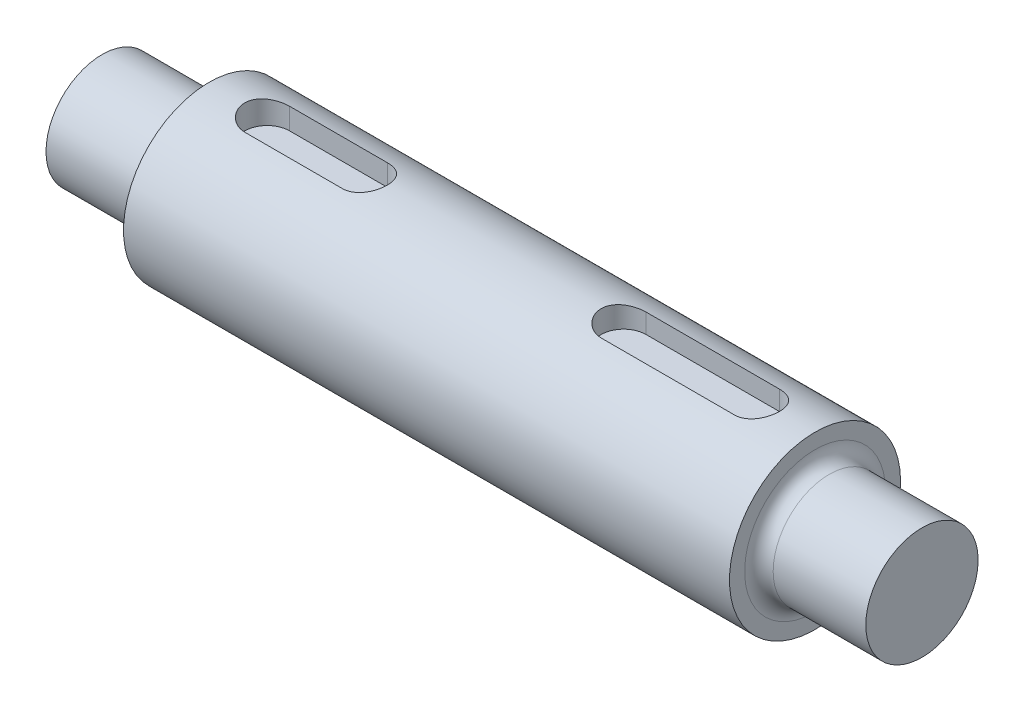
from build123d import *

# Parameters (mm, degrees)
SKETCH1_R                = 20
BOSS_EXTRUDE1_DEPTH      = 38.1
SKETCH2_R                = 30.48
BOSS_EXTRUDE2_DEPTH      = 215.9
SKETCH3_R                = 19.9999981
BOSS_EXTRUDE3_DEPTH      = 38.1
FILLET1_R                = 5.08
SKETCH6_W                = 16.002
SKETCH6_H                = 16.002
CUT_EXTRUDE1_DEPTH       = 50.8
SKETCH7_W                = 16
SKETCH7_H                = 16
CUT_EXTRUDE2_DEPTH       = 63.5
BOSS_EXTRUDE4_REACH      = 300.305
BOSS_EXTRUDE4_END_RADIUS = 30.48
BOSS_EXTRUDE5_REACH      = 300.423
BOSS_EXTRUDE5_END_RADIUS = 30.48


with BuildPart() as part:
    # Sketch1 → Boss-Extrude1 (new body)
    with BuildSketch(Plane(origin=(0, 0, 0), x_dir=(0, 0, -1), z_dir=(1, 0, 0))):
        with Locations(Location((0, 0, 0), (0, 0, 180))):
            Circle(SKETCH1_R)
    extrude(amount=BOSS_EXTRUDE1_DEPTH)

    # Sketch2 → Boss-Extrude2 (add)
    with BuildSketch(Plane(origin=(38.1, 0, 0), x_dir=(0, 0, -1), z_dir=(1, 0, 0))):
        Circle(SKETCH2_R)
    extrude(amount=BOSS_EXTRUDE2_DEPTH)

    # Sketch3 → Boss-Extrude3 (add)
    with BuildSketch(Plane(origin=(254, 0, 0), x_dir=(0, 0, -1), z_dir=(1, 0, 0))):
        with Locations(Location((0, 0, 0), (0, 0, 180))):
            Circle(SKETCH3_R)
    extrude(amount=BOSS_EXTRUDE3_DEPTH)

    # Fillet1
    fillet1_edges = [part.edges().sort_by_distance(p)[0] for p in [
        (38.1, 0, -20),
        (254, 0, -19.9999981),
    ]]
    fillet(fillet1_edges, radius=FILLET1_R)

    # Sketch6 → Cut-Extrude1 (cut)
    with BuildSketch(Plane(origin=(50.8, 0, 0), x_dir=(0, 0, -1), z_dir=(1, 0, 0))):
        with Locations((0, 29.812996)):
            Rectangle(SKETCH6_W, SKETCH6_H)
    extrude(amount=CUT_EXTRUDE1_DEPTH, mode=Mode.SUBTRACT)

    # Sketch7 → Cut-Extrude2 (cut)
    with BuildSketch(Plane.ZY.offset(-177.8)):
        with Locations((0, 30.48)):
            Rectangle(SKETCH7_W, SKETCH7_H)
    extrude(amount=-CUT_EXTRUDE2_DEPTH, mode=Mode.SUBTRACT)

    # Boss-Extrude4: up to this cylinder (the profile starts inside it)
    boss_extrude4_end = Plane(origin=(76.2, 0, 0), z_dir=(-1, 0, 0)) * Cylinder(BOSS_EXTRUDE4_END_RADIUS, 709.795666, mode=Mode.PRIVATE)
    # Sketch8 → Boss-Extrude4 (add, up to the surface)
    with BuildSketch(Plane(origin=(0, 21.811996, 0), x_dir=(1, 0, 0), z_dir=(0, 1, 0)), mode=Mode.PRIVATE) as boss_extrude4_sk1:
        with BuildLine():
            Line((58.801, 8.001), (50.8, 8.001))
            Line((50.8, 8.001), (50.8, 0))
            ThreePointArc((50.8, 0), (53.143438644, 5.657561356), (58.801, 8.001))
        make_face()
    boss_extrude4_tool1 = extrude(boss_extrude4_sk1.sketch, amount=BOSS_EXTRUDE4_REACH, mode=Mode.PRIVATE) & boss_extrude4_end
    add(boss_extrude4_tool1.solids().sort_by_distance((52.587167, 21.811996, -6.213833))[0])
    # Sketch8 → Boss-Extrude4 (add, up to the surface)
    with BuildSketch(Plane(origin=(0, 21.811996, 0), x_dir=(1, 0, 0), z_dir=(0, 1, 0)), mode=Mode.PRIVATE) as boss_extrude4_sk2:
        with BuildLine():
            ThreePointArc((58.801, -8.001), (53.143438644, -5.657561356), (50.8, 0))
            Line((50.8, 0), (50.8, -8.001))
            Line((50.8, -8.001), (58.801, -8.001))
        make_face()
    boss_extrude4_tool2 = extrude(boss_extrude4_sk2.sketch, amount=BOSS_EXTRUDE4_REACH, mode=Mode.PRIVATE) & boss_extrude4_end
    add(boss_extrude4_tool2.solids().sort_by_distance((52.587167, 21.811996, 6.213833))[0])
    # Sketch8 → Boss-Extrude4 (add, up to the surface)
    with BuildSketch(Plane(origin=(0, 21.811996, 0), x_dir=(1, 0, 0), z_dir=(0, 1, 0)), mode=Mode.PRIVATE) as boss_extrude4_sk3:
        with BuildLine():
            ThreePointArc((101.6, 0), (99.256561356, -5.657561356), (93.599, -8.001))
            Line((93.599, -8.001), (101.6, -8.001))
            Line((101.6, -8.001), (101.6, 0))
        make_face()
    boss_extrude4_tool3 = extrude(boss_extrude4_sk3.sketch, amount=BOSS_EXTRUDE4_REACH, mode=Mode.PRIVATE) & boss_extrude4_end
    add(boss_extrude4_tool3.solids().sort_by_distance((99.812833, 21.811996, 6.213833))[0])
    # Sketch8 → Boss-Extrude4 (add, up to the surface)
    with BuildSketch(Plane(origin=(0, 21.811996, 0), x_dir=(1, 0, 0), z_dir=(0, 1, 0)), mode=Mode.PRIVATE) as boss_extrude4_sk4:
        with BuildLine():
            Line((101.6, 8.001), (93.599, 8.001))
            ThreePointArc((93.599, 8.001), (99.256561356, 5.657561356), (101.6, 0))
            Line((101.6, 0), (101.6, 8.001))
        make_face()
    boss_extrude4_tool4 = extrude(boss_extrude4_sk4.sketch, amount=BOSS_EXTRUDE4_REACH, mode=Mode.PRIVATE) & boss_extrude4_end
    add(boss_extrude4_tool4.solids().sort_by_distance((99.812833, 21.811996, -6.213833))[0])

    # Boss-Extrude5: up to this cylinder (the profile starts inside it)
    boss_extrude5_end = Plane(origin=(209.55, 0, 0), z_dir=(-1, 0, 0)) * Cylinder(BOSS_EXTRUDE5_END_RADIUS, 722.732112, mode=Mode.PRIVATE)
    # Sketch10 → Boss-Extrude5 (add, up to the surface)
    with BuildSketch(Plane(origin=(0, 22.48, 0), x_dir=(1, 0, 0), z_dir=(0, 1, 0)), mode=Mode.PRIVATE) as boss_extrude5_sk1:
        with BuildLine():
            ThreePointArc((177.8, 0), (180.143145751, 5.656854249), (185.8, 8))
            Line((185.8, 8), (177.8, 8))
            Line((177.8, 8), (177.8, 0))
        make_face()
    boss_extrude5_tool1 = extrude(boss_extrude5_sk1.sketch, amount=BOSS_EXTRUDE5_REACH, mode=Mode.PRIVATE) & boss_extrude5_end
    add(boss_extrude5_tool1.solids().sort_by_distance((179.586944, 22.48, -6.213056))[0])
    # Sketch10 → Boss-Extrude5 (add, up to the surface)
    with BuildSketch(Plane(origin=(0, 22.48, 0), x_dir=(1, 0, 0), z_dir=(0, 1, 0)), mode=Mode.PRIVATE) as boss_extrude5_sk2:
        with BuildLine():
            ThreePointArc((185.8, -8), (180.143145751, -5.656854249), (177.8, 0))
            Line((177.8, 0), (177.8, -8))
            Line((177.8, -8), (185.8, -8))
        make_face()
    boss_extrude5_tool2 = extrude(boss_extrude5_sk2.sketch, amount=BOSS_EXTRUDE5_REACH, mode=Mode.PRIVATE) & boss_extrude5_end
    add(boss_extrude5_tool2.solids().sort_by_distance((179.586944, 22.48, 6.213056))[0])
    # Sketch10 → Boss-Extrude5 (add, up to the surface)
    with BuildSketch(Plane(origin=(0, 22.48, 0), x_dir=(1, 0, 0), z_dir=(0, 1, 0)), mode=Mode.PRIVATE) as boss_extrude5_sk3:
        with BuildLine():
            Line((241.3, -8), (241.3, 0))
            ThreePointArc((241.3, 0), (238.956854249, -5.656854249), (233.3, -8))
            Line((233.3, -8), (241.3, -8))
        make_face()
    boss_extrude5_tool3 = extrude(boss_extrude5_sk3.sketch, amount=BOSS_EXTRUDE5_REACH, mode=Mode.PRIVATE) & boss_extrude5_end
    add(boss_extrude5_tool3.solids().sort_by_distance((239.513056, 22.48, 6.213056))[0])
    # Sketch10 → Boss-Extrude5 (add, up to the surface)
    with BuildSketch(Plane(origin=(0, 22.48, 0), x_dir=(1, 0, 0), z_dir=(0, 1, 0)), mode=Mode.PRIVATE) as boss_extrude5_sk4:
        with BuildLine():
            Line((241.3, 8), (233.3, 8))
            ThreePointArc((233.3, 8), (238.956854249, 5.656854249), (241.3, 0))
            Line((241.3, 0), (241.3, 8))
        make_face()
    boss_extrude5_tool4 = extrude(boss_extrude5_sk4.sketch, amount=BOSS_EXTRUDE5_REACH, mode=Mode.PRIVATE) & boss_extrude5_end
    add(boss_extrude5_tool4.solids().sort_by_distance((239.513056, 22.48, -6.213056))[0])


solid = part.part
